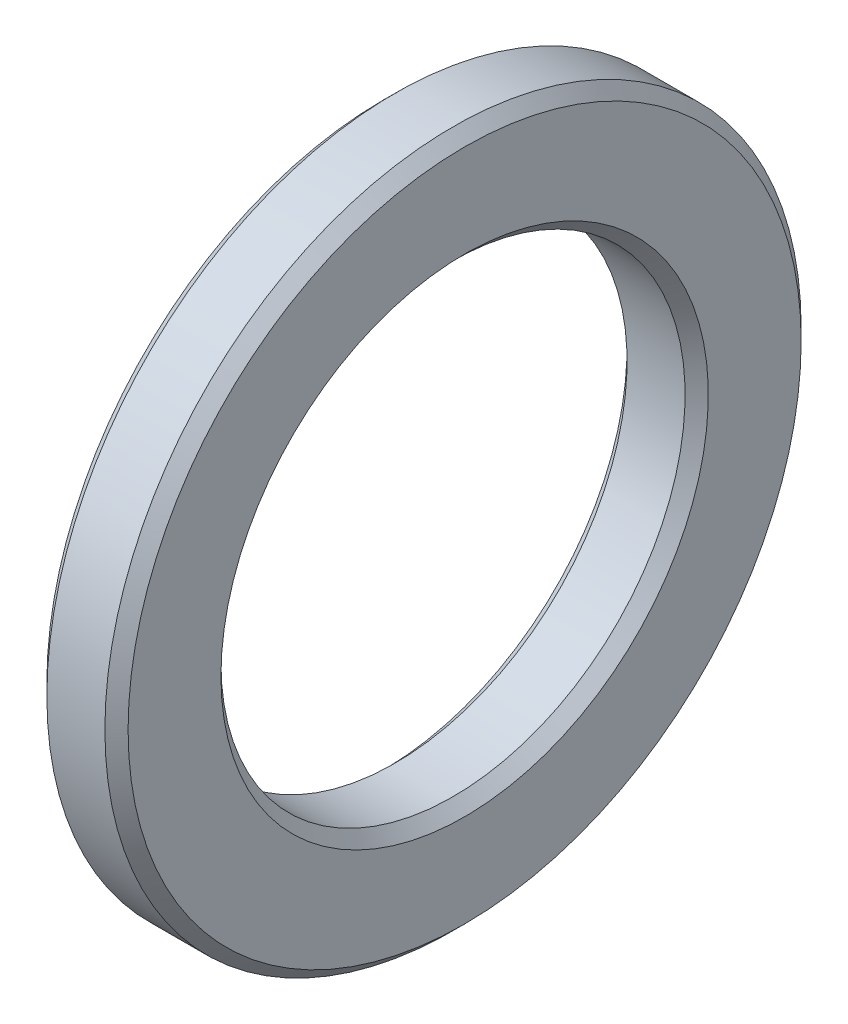
from build123d import *


with BuildPart() as part:
    # Esquisse1 → Révolution1 (revolve)
    with BuildSketch(Plane.XY, mode=Mode.PRIVATE) as r_volution1_sk:
        Polygon((0, 8.7), (0.3, 9), (1.8, 9), (2.1, 8.7), (2.1, 6.3), (1.8, 6), (0.3, 6), (0, 6.3), align=None)
    revolve(r_volution1_sk.sketch.rotate(Axis((-15.083050847, 0, 0), (1, 0, 0)), 90), axis=Axis((-15.083050847, 0, 0), (1, 0, 0)))


solid = part.part
